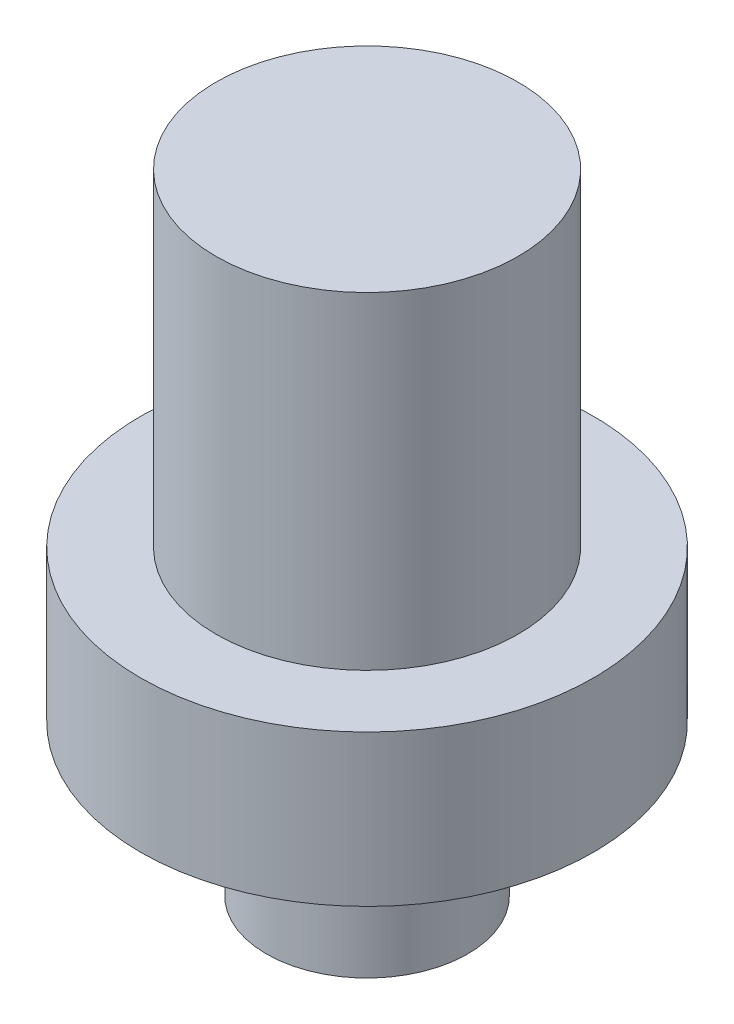
from build123d import *


with BuildPart() as part:
    # Sketch1 → Revolve1 (revolve)
    with BuildSketch(Plane.XY, mode=Mode.PRIVATE) as revolve1_sk:
        Polygon((0, -3), (2, -3), (2, 0), (4.5, 0), (4.5, 3), (3, 3), (3, 9.5), (0, 9.5), align=None)
    revolve(revolve1_sk.sketch.rotate(Axis((0, 4.57148633, 0), (0, -1, 0)), 90), axis=Axis((0, 4.57148633, 0), (0, -1, 0)))


solid = part.part
